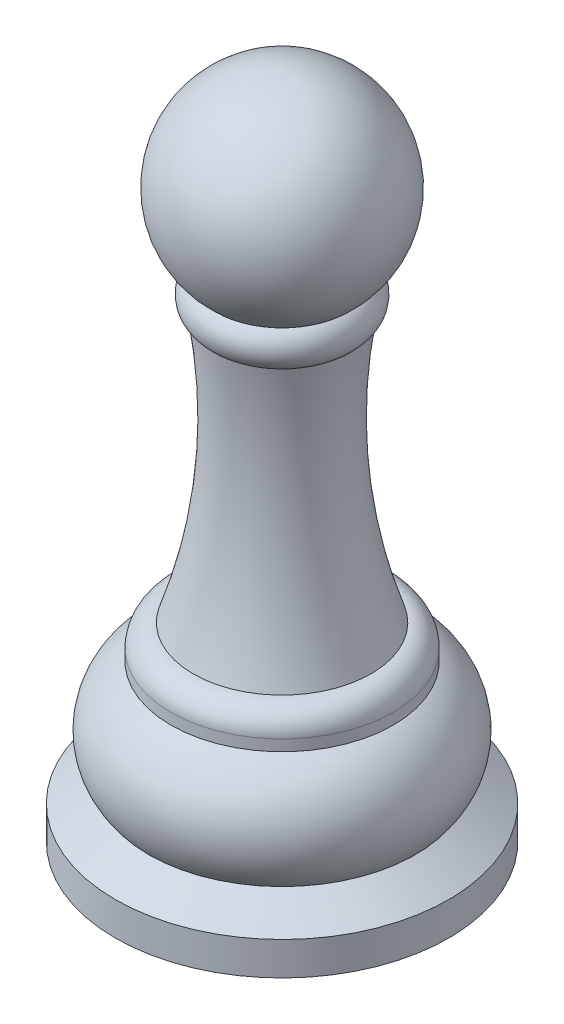
from build123d import *


with BuildPart() as part:
    # Sketch1 → Revolve1 (revolve)
    with BuildSketch(Plane.XY, mode=Mode.PRIVATE) as revolve1_sk:
        with BuildLine():
            Line((-10, -44.908203932), (-10, -45.908203932))
            ThreePointArc((-10, -45.908203932), (-13.162169665, -49.978471046), (-12, -55))
            Line((-12, -55), (-15, -57))
            Line((-15, -57), (-15, -60))
            Line((-15, -60), (0, -60))
            Line((0, -60), (0, 0))
            ThreePointArc((0, 0), (-8.407551231, -5.788601192), (-6, -15.708203932))
            ThreePointArc((-6, -15.708203932), (-6.8, -17.308203932), (-6, -18.908203932))
            ThreePointArc((-6, -18.908203932), (-5.533425696, -31.030418458), (-8, -42.908203932))
            ThreePointArc((-8, -42.908203932), (-9.414213562, -43.49399037), (-10, -44.908203932))
        make_face()
    revolve(revolve1_sk.sketch.rotate(Axis((0, 67.872071481, 0), (0, -1, 0)), 270), axis=Axis((0, 67.872071481, 0), (0, -1, 0)))


solid = part.part
